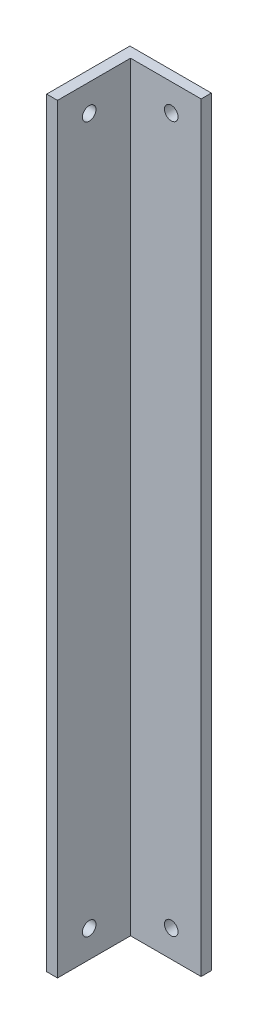
from build123d import *

# Parameters (mm, degrees)
EXTRUDE_1_DEPTH        = 280
HOLE_WIZARD_M6_3_D     = 5
HOLE_WIZARD_M6_3_DEPTH = 17
HOLE_WIZARD_M6_3_TIP   = 1.502151548
HOLE_WIZARD_M6_4_D     = 5
HOLE_WIZARD_M6_4_DEPTH = 17
HOLE_WIZARD_M6_4_TIP   = 1.502151548


with BuildPart() as part:
    # 草图1 → 凸台-拉伸1 (new body)
    with BuildSketch(Plane(origin=(0, 0, 0), x_dir=(1, 0, 0), z_dir=(0, 1, 0))):
        Polygon((-119.239761807, 232.240117312), (-89.239761807, 232.240117312), (-89.239761807, 228.470843435), (-115.239761807, 228.470843435), (-115.239761807, 201.561077594), (-119.239761807, 201.561077594), (-119.239761807, 228.23121253), align=None)
    extrude(amount=EXTRUDE_1_DEPTH)

    # M6 螺纹孔3
    with Locations(Plane.ZY.offset(119.239761807)):
        with Locations((-213.240117312, 10), (-213.240117312, 270)):
            Hole(HOLE_WIZARD_M6_3_D / 2, depth=HOLE_WIZARD_M6_3_DEPTH)
            with Locations((0, 0, -(HOLE_WIZARD_M6_3_DEPTH + HOLE_WIZARD_M6_3_TIP / 2))):  # 118° drill point
                Cone(0, HOLE_WIZARD_M6_3_D / 2, HOLE_WIZARD_M6_3_TIP, mode=Mode.SUBTRACT)

    # M6 螺纹孔4
    with Locations(Plane(origin=(0, 0, -232.240117312), x_dir=(-1, 0, 0), z_dir=(0, 0, -1))):
        with Locations((100.239761807, 10), (100.239761807, 270)):
            Hole(HOLE_WIZARD_M6_4_D / 2, depth=HOLE_WIZARD_M6_4_DEPTH)
            with Locations((0, 0, -(HOLE_WIZARD_M6_4_DEPTH + HOLE_WIZARD_M6_4_TIP / 2))):  # 118° drill point
                Cone(0, HOLE_WIZARD_M6_4_D / 2, HOLE_WIZARD_M6_4_TIP, mode=Mode.SUBTRACT)


solid = part.part
